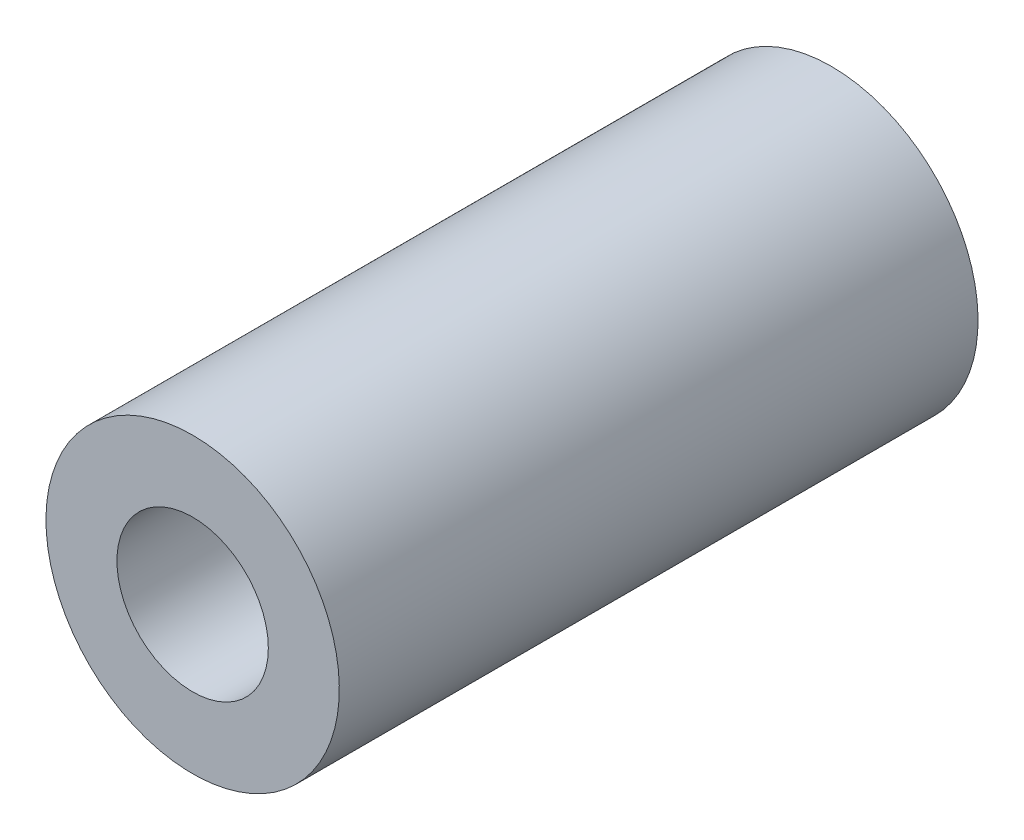
from build123d import *

# Parameters (mm, degrees)
SKETCH1_R           = 3.1
SKETCH1_R_2         = 1.6
EXTRUDE_THIN1_DEPTH = 13.5


with BuildPart() as part:
    # Sketch1 → Extrude-Thin1 (new body)
    with BuildSketch(Plane(origin=(0, 0, 0), x_dir=(0, 1, 0), z_dir=(0, 0, 1))):
        Circle(SKETCH1_R)
        Circle(SKETCH1_R_2, mode=Mode.SUBTRACT)
    extrude(amount=EXTRUDE_THIN1_DEPTH)


solid = part.part
